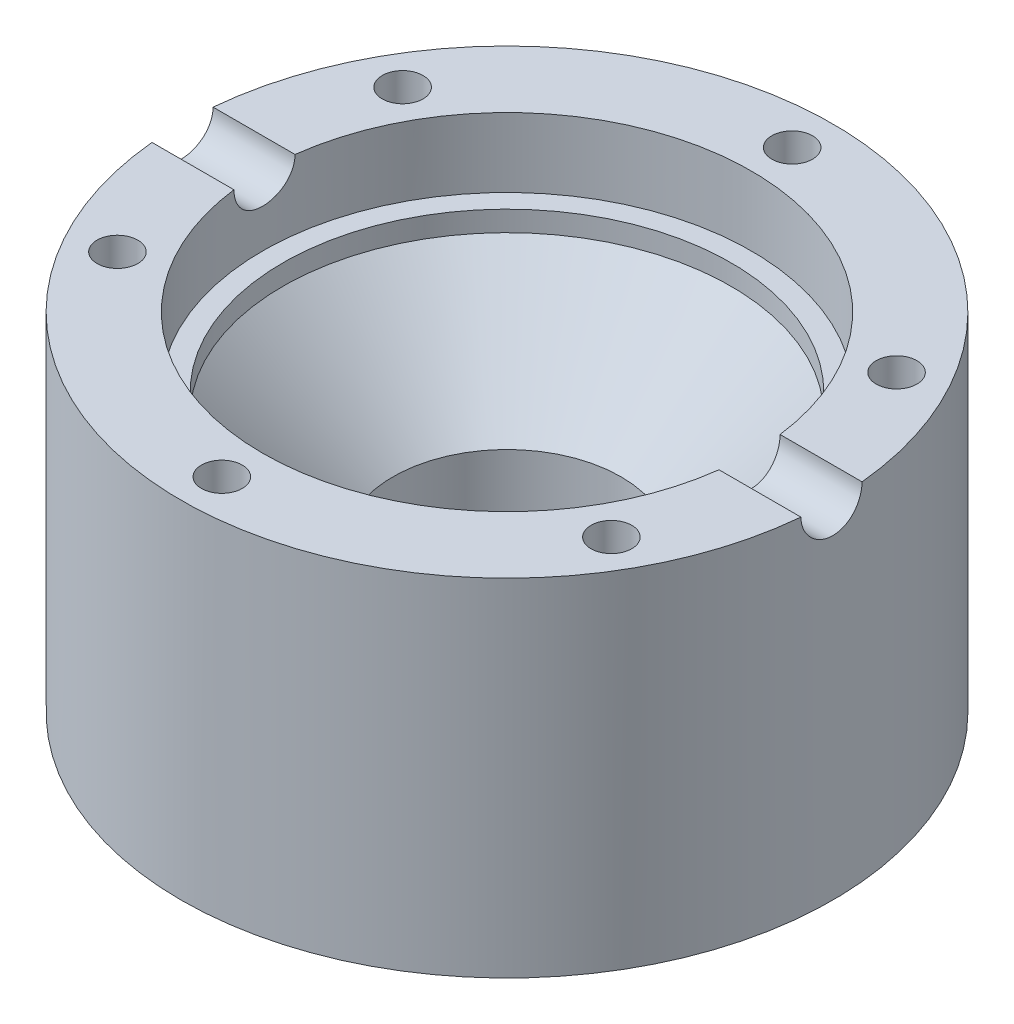
from build123d import *

# Parameters (mm, degrees)
SKETCH1_R           = 20.32
BOSS_EXTRUDE1_DEPTH = 21.59
SKETCH2_W           = 15.24
SKETCH2_H           = 4.318
CUT_EXTRUDE1_REACH  = 37.943
SKETCH4_R           = 1.27
CIRPATTERN1_COUNT   = 6
SKETCH9_R           = 1.905
CUT_EXTRUDE3_DEPTH  = 51.305467894
SKETCH10_R          = 7.112
CUT_EXTRUDE8_DEPTH  = 17.272


with BuildPart() as part:
    # Sketch1 → Boss-Extrude1 (new body)
    with BuildSketch(Plane(origin=(0, 0, 0), x_dir=(1, 0, 0), z_dir=(0, 1, 0))):
        with Locations(Location((0, 0, 0), (0, 0, 270))):
            Circle(SKETCH1_R)
    extrude(amount=BOSS_EXTRUDE1_DEPTH)

    # Sketch2 → Cut-Revolve1 (revolve, cut)
    with BuildSketch(Plane.XY, mode=Mode.PRIVATE) as cut_revolve1_sk:
        with Locations((-7.62, 19.431)):
            Rectangle(SKETCH2_W, SKETCH2_H)
    revolve(cut_revolve1_sk.sketch.rotate(Axis((0, 22.78347084, 0), (0, -1, 0)), 270), axis=Axis((0, 22.78347084, 0), (0, -1, 0)), mode=Mode.SUBTRACT)

    # Sketch4 → Cut-Extrude1 (cut, up to next)
    with BuildSketch(Plane(origin=(0, 21.59, 0), x_dir=(1, 0, 0), z_dir=(0, 1, 0)), mode=Mode.PRIVATE) as cut_extrude1_sk1:
        with Locations(Location((0, 17.78, 0), (0, 0, 270))):
            Circle(SKETCH4_R)
    cut_extrude1_tool1 = extrude(cut_extrude1_sk1.sketch, amount=-CUT_EXTRUDE1_REACH, mode=Mode.PRIVATE) & part.part
    cut_extrude1 = cut_extrude1_tool1.solids().sort_by_distance((0, 21.59, -17.78))[0]
    add(cut_extrude1, mode=Mode.SUBTRACT)

    # CirPattern1: Cut-Extrude1 ×6 about axis
    cirpattern1_axis = Axis((0, 0, 0), (0, 1, 0))
    for i in range(1, CIRPATTERN1_COUNT):
        add(cut_extrude1.rotate(cirpattern1_axis, i * 360 / CIRPATTERN1_COUNT), mode=Mode.SUBTRACT)

    # Sketch8 → Cut-Revolve4 (revolve, cut)
    with BuildSketch(Plane.XY, mode=Mode.PRIVATE) as cut_revolve4_sk:
        Polygon((-4.699, 17.272), (-13.97, 17.272), (-13.97, 16.002), (-4.699, 6.731), align=None)
    revolve(cut_revolve4_sk.sketch.rotate(Axis((0, 22.78347084, 0), (0, -1, 0)), 270), axis=Axis((0, 22.78347084, 0), (0, -1, 0)), mode=Mode.SUBTRACT)

    # Sketch9 → Cut-Extrude3 (cut, through all)
    with BuildSketch(Plane(origin=(20.32, 0, 0), x_dir=(0, 0, -1), z_dir=(1, 0, 0))):
        with Locations((0, 21.59)):
            Circle(SKETCH9_R)
    extrude(amount=-CUT_EXTRUDE3_DEPTH, mode=Mode.SUBTRACT)

    # Sketch10 → Cut-Extrude8 (cut)
    with BuildSketch(Plane(origin=(0, 0, 0), x_dir=(1, 0, 0), z_dir=(0, 1, 0))):
        with Locations(Location((0, 0, 0), (0, 0, 270))):
            Circle(SKETCH10_R)
    extrude(amount=CUT_EXTRUDE8_DEPTH, mode=Mode.SUBTRACT)


solid = part.part
